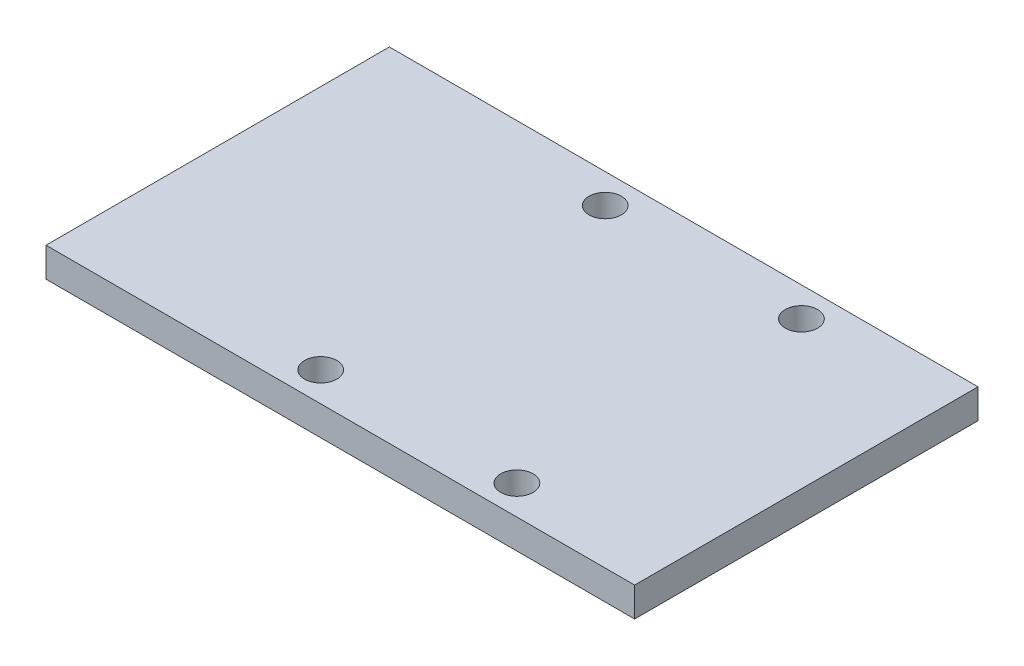
from build123d import *

# Parameters (mm, degrees)
SKETCH_1_W          = 60
SKETCH_1_H          = 35
EXTRUDE_1_DEPTH     = 3
SKETCH_2_R          = 1.65
CUT_EXTRUDE_1_DEPTH = 3


with BuildPart() as part:
    # 草图1 → 凸台-拉伸1 (new body)
    with BuildSketch(Plane(origin=(0, 0, 0), x_dir=(1, 0, 0), z_dir=(0, 1, 0))):
        Rectangle(SKETCH_1_W, SKETCH_1_H)
    extrude(amount=EXTRUDE_1_DEPTH)

    # 草图2 → 切除-拉伸1 (cut)
    with BuildSketch(Plane.XZ):
        with Locations(Location((15, 14.5, 0), (0, 0, 270))):
            Circle(SKETCH_2_R)
        with Locations(Location((-5, 14.5, 0), (0, 0, 270))):
            Circle(SKETCH_2_R)
        with Locations(Location((-5, -14.5, 0), (0, 0, 270))):
            Circle(SKETCH_2_R)
        with Locations(Location((15, -14.5, 0), (0, 0, 270))):
            Circle(SKETCH_2_R)
    extrude(amount=-CUT_EXTRUDE_1_DEPTH, mode=Mode.SUBTRACT)


solid = part.part
